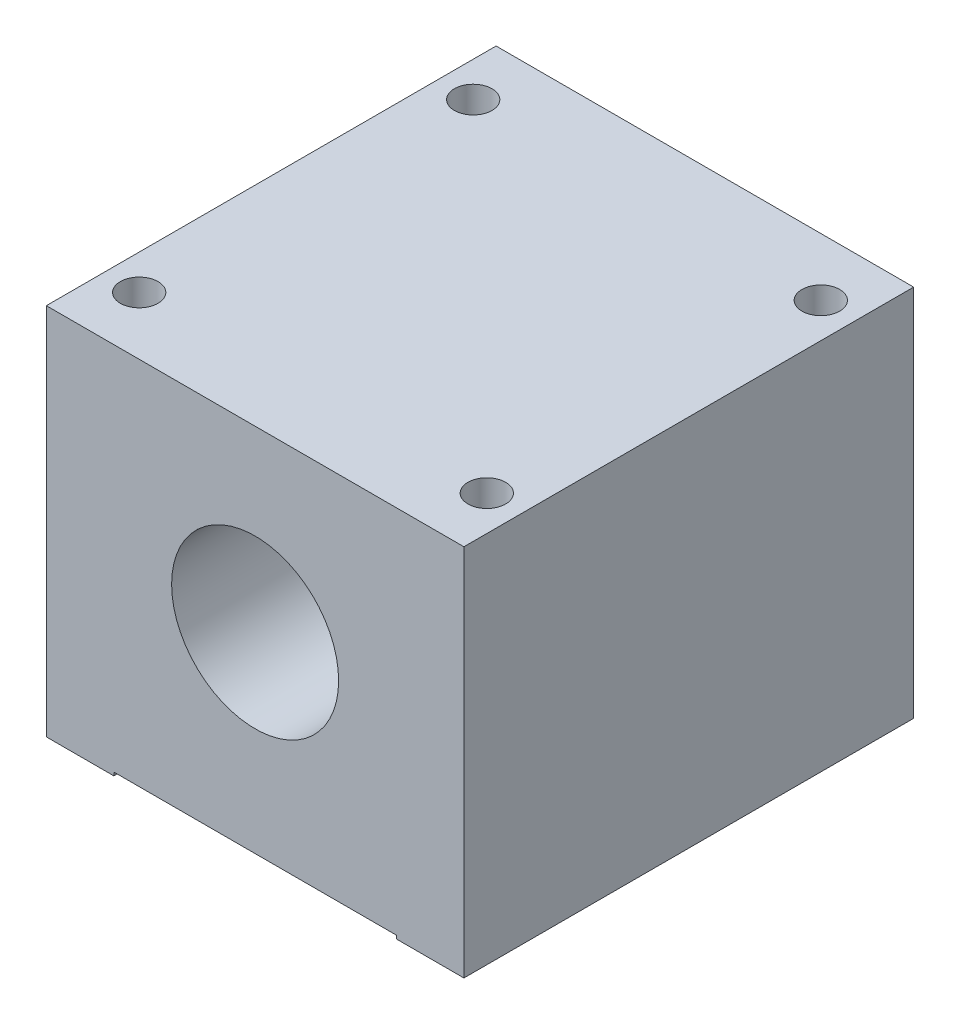
from build123d import *

# Parameters (mm, degrees)
SKETCH1_W           = 47.63
SKETCH1_H           = 51.3
SKETCH1_R           = 2.15
BOSS_EXTRUDE1_DEPTH = 42.6
SKETCH2_R           = 9.525
CUT_EXTRUDE1_DEPTH  = 98.066930034
SKETCH3_W           = 32.23
SKETCH3_H           = 57.048665503
CUT_EXTRUDE2_DEPTH  = 0.38


with BuildPart() as part:
    # Sketch1 → Boss-Extrude1 (new body)
    with BuildSketch(Plane(origin=(0, 0, 0), x_dir=(1, 0, 0), z_dir=(0, 1, 0))):
        with Locations((-46.7225, 12.267391304)):
            Rectangle(SKETCH1_W, SKETCH1_H)
        with Locations(Location((-66.5475, 31.317391304, 0), (0, 0, 270))):
            Circle(SKETCH1_R, mode=Mode.SUBTRACT)
        with Locations(Location((-26.8975, 31.317391304, 0), (0, 0, 270))):
            Circle(SKETCH1_R, mode=Mode.SUBTRACT)
        with Locations(Location((-66.5475, -6.782608696, 0), (0, 0, 270))):
            Circle(SKETCH1_R, mode=Mode.SUBTRACT)
        with Locations(Location((-26.8975, -6.782608696, 0), (0, 0, 270))):
            Circle(SKETCH1_R, mode=Mode.SUBTRACT)
    extrude(amount=BOSS_EXTRUDE1_DEPTH)

    # Sketch2 → Cut-Extrude1 (cut, through all)
    with BuildSketch(Plane.XY.offset(13.382608696)):
        with Locations((-46.7225, 22.23)):
            Circle(SKETCH2_R)
    extrude(amount=-CUT_EXTRUDE1_DEPTH, mode=Mode.SUBTRACT)

    # Sketch3 → Cut-Extrude2 (cut)
    with BuildSketch(Plane.XZ):
        with Locations((-46.7225, -11.363905652)):
            Rectangle(SKETCH3_W, SKETCH3_H)
    extrude(amount=-CUT_EXTRUDE2_DEPTH, mode=Mode.SUBTRACT)


solid = part.part
